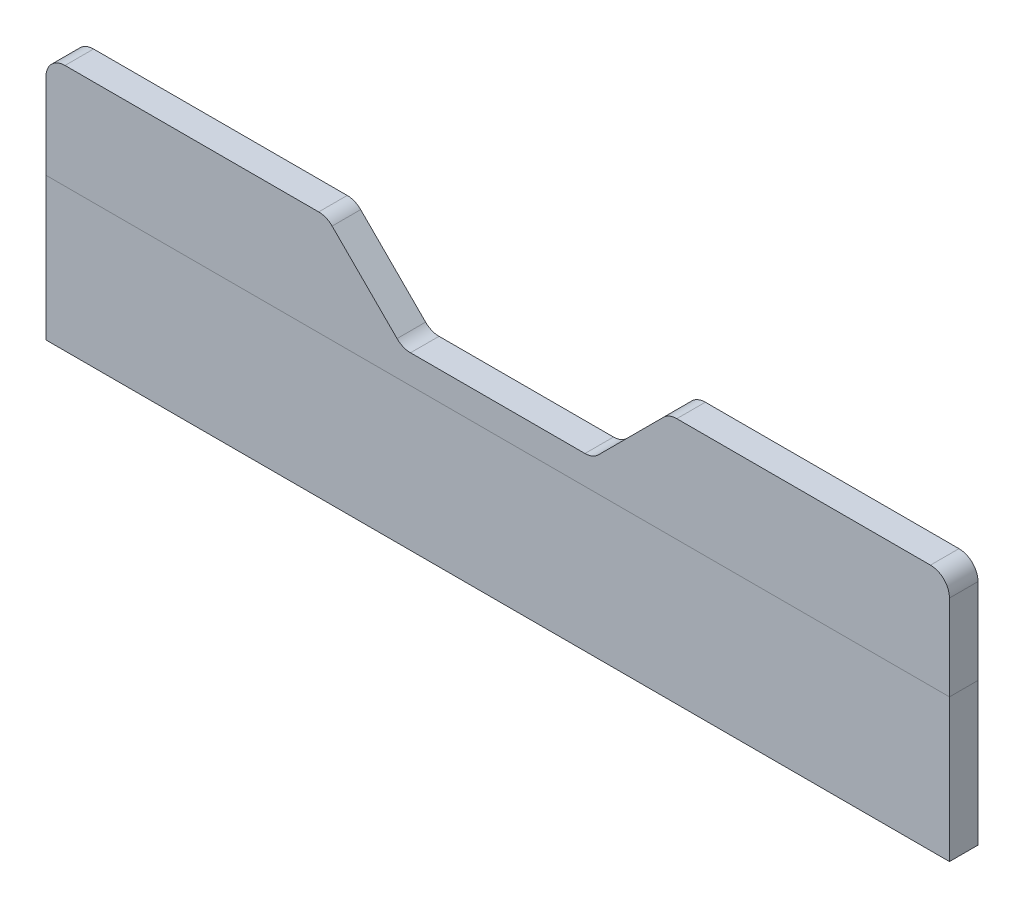
from build123d import *

# Parameters (mm, degrees)
SKETCH1_W           = 47.5
SKETCH1_H           = 7.5
BOSS_EXTRUDE1_DEPTH = 1.5
BOSS_EXTRUDE2_DEPTH = 1.5
FILLET1_R           = 1
SCALE1_SCALE        = 10


with BuildPart() as part:
    # Sketch1 → Boss-Extrude1 (new body)
    with BuildSketch(Plane.XY):
        with Locations((23.75, 3.75)):
            Rectangle(SKETCH1_W, SKETCH1_H)
    extrude(amount=-BOSS_EXTRUDE1_DEPTH)


with BuildPart() as body_2:
    # Sketch2 → Boss-Extrude2 (new body)
    with BuildSketch(Plane.XY):
        Polygon((0, 7.5), (47.5, 7.5), (47.5, 13), (32.75, 13), (28.75, 9), (18.75, 9), (14.75, 13), (0, 13), align=None)
    extrude(amount=-BOSS_EXTRUDE2_DEPTH)

    # Fillet1
    fillet1_edges = [body_2.edges().sort_by_distance(p)[0] for p in [
        (0, 13, -0.75),
        (14.75, 13, -0.75),
        (18.75, 9, -0.75),
        (28.75, 9, -0.75),
        (32.75, 13, -0.75),
        (47.5, 13, -0.75),
    ]]
    fillet(fillet1_edges, radius=FILLET1_R)


with BuildPart() as part_1:
    # Scale1: scaled about (0, 0, 0)
    add(part.part.scale(SCALE1_SCALE))


with BuildPart() as body_2_1:
    # Scale1: scaled about (0, 0, 0)
    add(body_2.part.scale(SCALE1_SCALE))


solid = Compound([part_1.part, body_2_1.part])
